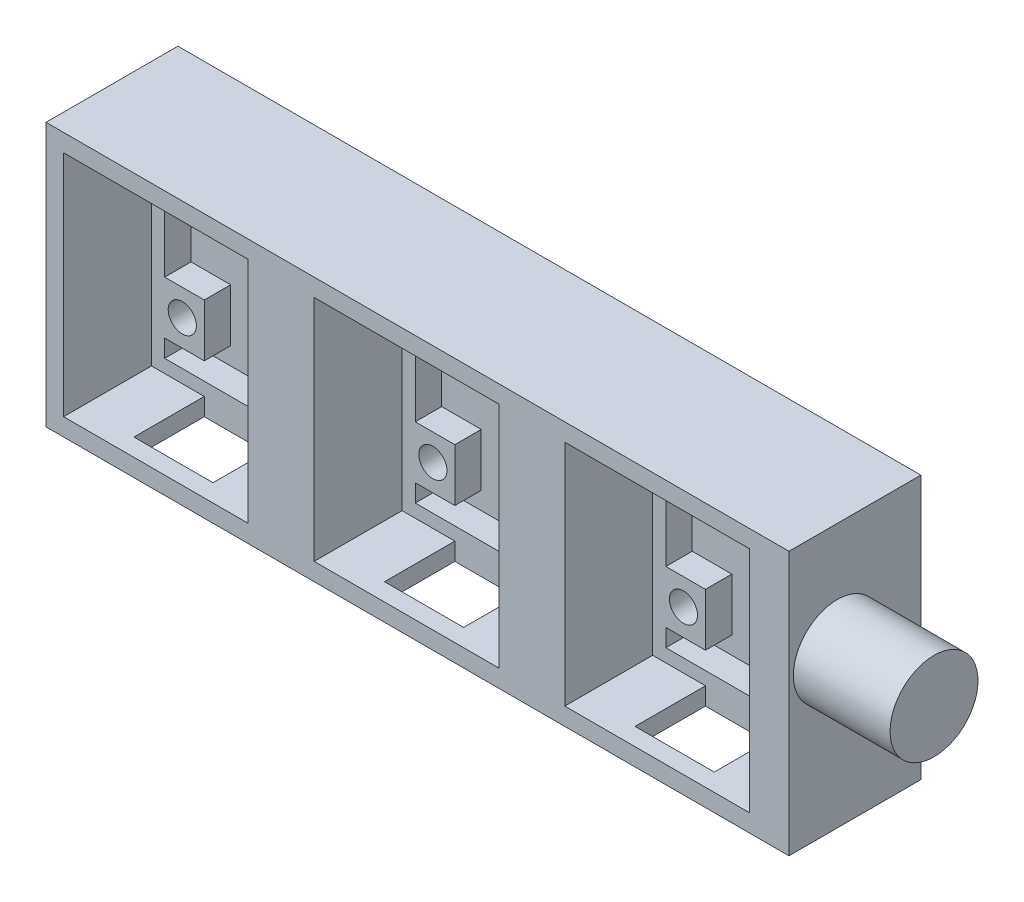
from build123d import *

# Parameters (mm, degrees)
SKETCH_1_W          = 84.5
SKETCH_1_H          = 30
EXTRUDE_1_DEPTH     = 15
SKETCH_2_W          = 21
SKETCH_2_H          = 26
CUT_EXTRUDE_1_DEPTH = 13
SKETCH_3_W          = 21
SKETCH_3_H          = 26
SKETCH_3_W_2        = 18
SKETCH_3_H_2        = 23
EXTRUDE_2_DEPTH     = 3
SKETCH_5_W          = 4.5
SKETCH_5_H          = 6
EXTRUDE_3_DEPTH     = 3
SKETCH_6_R          = 1.6
CUT_EXTRUDE_2_DEPTH = 94.778887913
SKETCH_7_W          = 9
SKETCH_7_H          = 8
CUT_EXTRUDE_3_DEPTH = 90.714734825
SKETCH_13_W         = 1.8
SKETCH_13_H         = 4.8
EXTRUDE_4_DEPTH     = 3
SKETCH_14_R         = 5
EXTRUDE_5_DEPTH     = 11


with BuildPart() as part:
    # ｽｹｯﾁ1 → ﾎﾞｽ - 押し出し1 (new body)
    with BuildSketch(Plane.XY):
        with Locations((-41.65312059, 25.678571429)):
            Rectangle(SKETCH_1_W, SKETCH_1_H)
    extrude(amount=EXTRUDE_1_DEPTH)

    # ｽｹｯﾁ2 → ｶｯﾄ - 押し出し1 (cut)
    with BuildSketch(Plane.XY.offset(15)):
        with Locations((-71.40312059, 25.678571429)):
            Rectangle(SKETCH_2_W, SKETCH_2_H)
        with Locations((-42.90312059, 25.678571429)):
            Rectangle(SKETCH_2_W, SKETCH_2_H)
        with Locations((-14.40312059, 25.678571429)):
            Rectangle(SKETCH_2_W, SKETCH_2_H)
    extrude(amount=-CUT_EXTRUDE_1_DEPTH, mode=Mode.SUBTRACT)

    # ｽｹｯﾁ3 → ﾎﾞｽ - 押し出し2 (add)
    # profile 1 of 3: a face of its own
    with BuildSketch(Plane.XY.offset(2)):
        with Locations((-71.40312059, 25.678571429)):
            Rectangle(SKETCH_3_W, SKETCH_3_H)
        with Locations((-71.40312059, 25.678571429)):
            Rectangle(SKETCH_3_W_2, SKETCH_3_H_2, mode=Mode.SUBTRACT)
    # profile 2 of 3: a face of its own
    with BuildSketch(Plane.XY.offset(2)):
        with Locations((-42.90312059, 25.678571429)):
            Rectangle(SKETCH_3_W, SKETCH_3_H)
        with Locations((-42.90312059, 25.678571429)):
            Rectangle(SKETCH_3_W_2, SKETCH_3_H_2, mode=Mode.SUBTRACT)
    # profile 3 of 3: a face of its own
    with BuildSketch(Plane.XY.offset(2)):
        with Locations((-14.40312059, 25.678571429)):
            Rectangle(SKETCH_3_W, SKETCH_3_H)
        with Locations((-14.40312059, 25.678571429)):
            Rectangle(SKETCH_3_W_2, SKETCH_3_H_2, mode=Mode.SUBTRACT)
    extrude(amount=EXTRUDE_2_DEPTH)

    # ｽｹｯﾁ5 → ﾎﾞｽ - 押し出し3 (add)
    with BuildSketch(Plane.XY.offset(2)):
        with Locations((-64.65312059, 19.178571429)):
            Rectangle(SKETCH_5_W, SKETCH_5_H)
        with Locations((-78.15312059, 19.178571429)):
            Rectangle(SKETCH_5_W, SKETCH_5_H)
        with Locations((-49.65312059, 19.178571429)):
            Rectangle(SKETCH_5_W, SKETCH_5_H)
        with Locations((-36.15312059, 19.178571429)):
            Rectangle(SKETCH_5_W, SKETCH_5_H)
        with Locations((-21.15312059, 19.178571429)):
            Rectangle(SKETCH_5_W, SKETCH_5_H)
        with Locations((-7.65312059, 19.178571429)):
            Rectangle(SKETCH_5_W, SKETCH_5_H)
    extrude(amount=EXTRUDE_3_DEPTH)

    # ｽｹｯﾁ6 → ｶｯﾄ - 押し出し2 (cut, through all)
    with BuildSketch(Plane.XY.offset(5)):
        with Locations((-64.40312059, 19.178571429)):
            Circle(SKETCH_6_R)
        with Locations((-78.40312059, 19.178571429)):
            Circle(SKETCH_6_R)
        with Locations((-49.90312059, 19.178571429)):
            Circle(SKETCH_6_R)
        with Locations((-35.90312059, 19.178571429)):
            Circle(SKETCH_6_R)
        with Locations((-21.40312059, 19.178571429)):
            Circle(SKETCH_6_R)
        with Locations((-7.40312059, 19.178571429)):
            Circle(SKETCH_6_R)
    extrude(amount=-CUT_EXTRUDE_2_DEPTH, mode=Mode.SUBTRACT)

    # ｽｹｯﾁ7 → ｶｯﾄ - 押し出し3 (cut, through all)
    with BuildSketch(Plane(origin=(0, 12.678571429, 0), x_dir=(1, 0, 0), z_dir=(0, 1, 0))):
        with Locations((-71.40312059, -9)):
            Rectangle(SKETCH_7_W, SKETCH_7_H)
        with Locations((-42.90312059, -9)):
            Rectangle(SKETCH_7_W, SKETCH_7_H)
        with Locations((-14.40312059, -9)):
            Rectangle(SKETCH_7_W, SKETCH_7_H)
    extrude(amount=-CUT_EXTRUDE_3_DEPTH, mode=Mode.SUBTRACT)

    # ｽｹｯﾁ13 → ﾎﾞｽ - 押し出し4 (add)
    with BuildSketch(Plane.ZY.offset(83.90312059)):
        with Locations((0.9, 33.178571429)):
            Rectangle(SKETCH_13_W, SKETCH_13_H)
        with Locations((0.9, 18.178571429)):
            Rectangle(SKETCH_13_W, SKETCH_13_H)
    extrude(amount=EXTRUDE_4_DEPTH)

    # ｽｹｯﾁ14 → ﾎﾞｽ - 押し出し5 (add)
    with BuildSketch(Plane(origin=(0.59687941, 0, 0), x_dir=(0, 0, -1), z_dir=(1, 0, 0))):
        with Locations(Location((-9.5, 28.178571429, 0), (0, 0, 180))):
            Circle(SKETCH_14_R)
    extrude(amount=EXTRUDE_5_DEPTH)


solid = part.part
